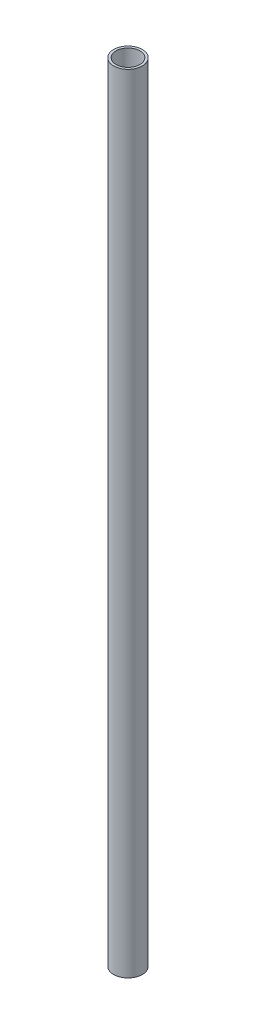
from build123d import *

# Parameters (mm, degrees)
SKETCH1_R           = 6
SKETCH1_R_2         = 5
BOSS_EXTRUDE1_DEPTH = 330


with BuildPart() as part:
    # Sketch1 → Boss-Extrude1 (new body)
    with BuildSketch(Plane(origin=(0, 0, 0), x_dir=(1, 0, 0), z_dir=(0, 1, 0))):
        with Locations(Location((0, 0, 0), (0, 0, 270))):
            Circle(SKETCH1_R)
        with Locations(Location((0, 0, 0), (0, 0, 270))):
            Circle(SKETCH1_R_2, mode=Mode.SUBTRACT)
    extrude(amount=BOSS_EXTRUDE1_DEPTH)


solid = part.part
